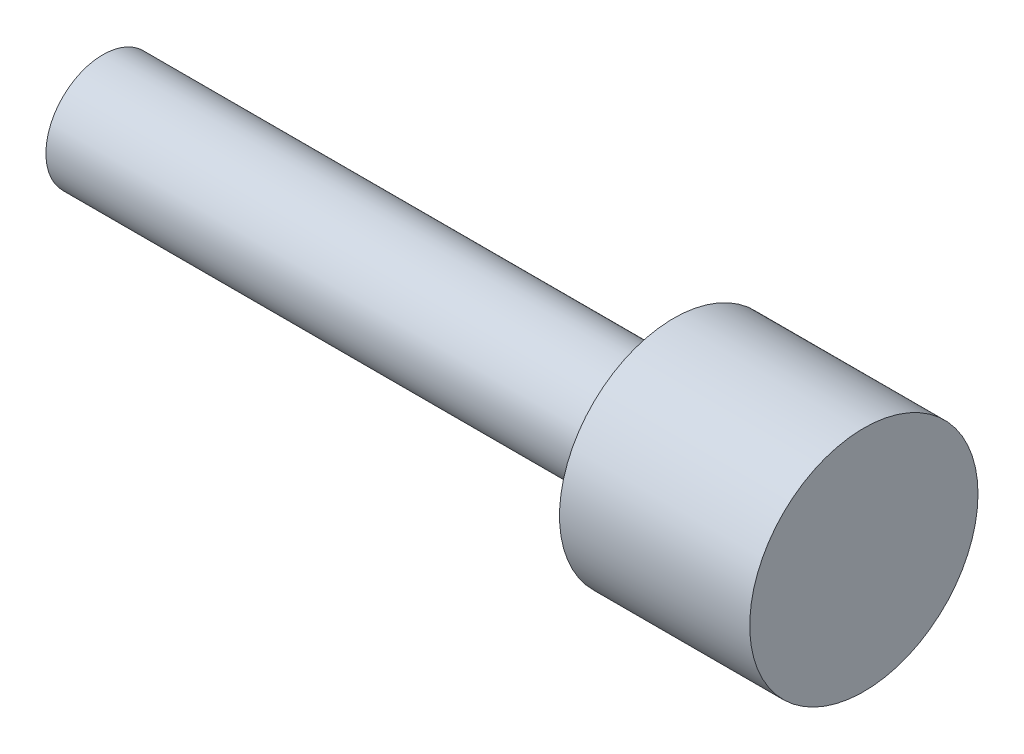
from build123d import *


with BuildPart() as part:
    # Sketch1 → Revolve1 (revolve)
    with BuildSketch(Plane.XY, mode=Mode.PRIVATE) as revolve1_sk:
        Polygon((0, 0), (0, 3), (30, 3), (30, 6), (40, 6), (40, 0), align=None)
    revolve(revolve1_sk.sketch.rotate(Axis((40, 0, 0), (-1, 0, 0)), 90), axis=Axis((40, 0, 0), (-1, 0, 0)))


solid = part.part
